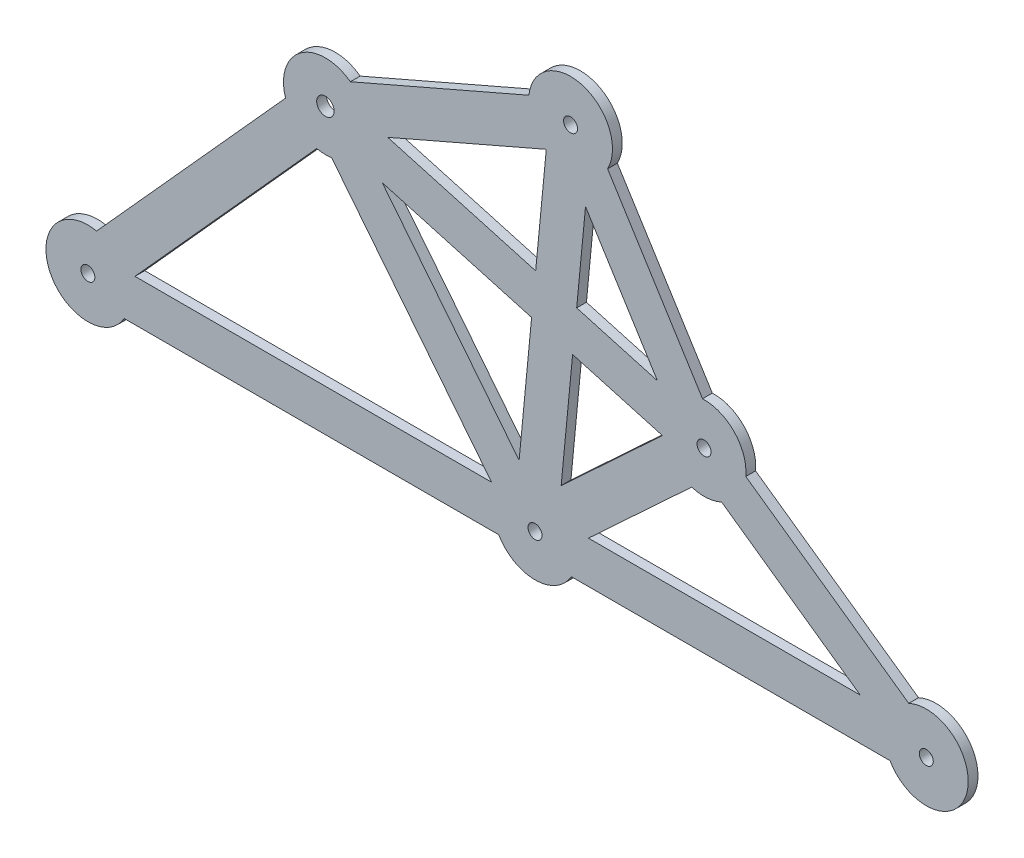
from build123d import *

# Parameters (mm, degrees)
SKETCH2_W           = 635
SKETCH2_H           = 635
BOSS_EXTRUDE3_DEPTH = 4.445
SKETCH3_R           = 3.175
SKETCH3_R_2         = 3.9751
CUT_EXTRUDE1_DEPTH  = 631.349772348
SKETCH4_W           = 635
SKETCH4_H           = 635
SKETCH4_R           = 3.175
CUT_EXTRUDE2_DEPTH  = 631.349772348


with BuildPart() as part:
    # Sketch2 → Boss-Extrude3 (new body)
    with BuildSketch(Plane.XY):
        with Locations((164.767692446, -88.380463065)):
            Rectangle(SKETCH2_W, SKETCH2_H)
    extrude(amount=BOSS_EXTRUDE3_DEPTH)

    # Sketch3 → Cut-Extrude1 (cut, through all)
    with BuildSketch(Plane(origin=(0, 0, 0), x_dir=(-1, 0, 0), z_dir=(0, 0, -1))):
        with Locations((-138.143199548, 71.871365193)):
            Circle(SKETCH3_R)
        with Locations((-198.809547248, -25.000118004)):
            Circle(SKETCH3_R)
        with Locations((-122.004659563, -96.265887155)):
            Circle(SKETCH3_R)
        with Locations((-26.754659563, 23.469712845)):
            Circle(SKETCH3_R_2)
    extrude(amount=-CUT_EXTRUDE1_DEPTH, mode=Mode.SUBTRACT)

    # Sketch4 → Cut-Extrude2 (cut, through all)
    # profile 1 of 9: a face of its own
    with BuildSketch(Plane.XY.offset(4.445)):
        with Locations((164.767692446, -88.380463065)):
            Rectangle(SKETCH4_W, SKETCH4_H)
        with BuildLine():
            Line((-77.2226341, -77.634727654), (8.633248965, 17.594597704))
            ThreePointArc((8.633248965, 17.594597704), (15.63151489, 38.935098471), (38.089671454, 38.780493538))
            Line((38.089671454, 38.780493538), (119.216168571, 74.032383096))
            ThreePointArc((119.216168571, 74.032383096), (143.785411305, 90.066637834), (154.972256192, 62.944699943))
            Line((154.972256192, 62.944699943), (198.125737804, -5.962394804))
            ThreePointArc((198.125737804, -5.962394804), (212.645203515, -11.905190907), (217.780898828, -26.729371954))
            Line((217.780898828, -26.729371954), (291.816561623, -78.971587768))
            ThreePointArc((291.816561623, -78.971587768), (317.962531349, -102.027327271), (283.306875621, -105.790887155))
            Line((283.306875621, -105.790887155), (138.502443505, -105.790887155))
            ThreePointArc((138.502443505, -105.790887155), (122.004659563, -115.315887155), (105.506875621, -105.790887155))
            Line((105.506875621, -105.790887155), (-64.697556495, -105.790887155))
            ThreePointArc((-64.697556495, -105.790887155), (-98.60087325, -104.008621005), (-77.2226341, -77.634727654))
        make_face(mode=Mode.SUBTRACT)
    # profile 2 of 9: a face of its own
    with BuildSketch(Plane.XY.offset(4.445)):
        with BuildLine():
            Line((146.273652248, -86.740887155), (269.785475941, -86.740887155))
            Line((269.785475941, -86.740887155), (206.797645188, -42.294417391))
            ThreePointArc((206.797645188, -42.294417391), (200.080272342, -44.007689067), (193.194620104, -43.203828976))
            Line((193.194620104, -43.203828976), (146.273652248, -86.740887155))
        make_face()
    # profile 3 of 9: a face of its own
    with BuildSketch(Plane.XY.offset(4.445)):
        Polygon((144.946705866, 43.06176458), (140.928758156, 1.201305791), (177.638536292, -9.140258814), align=None)
    # profile 4 of 9: a face of its own
    with BuildSketch(Plane.XY.offset(4.445)):
        Polygon((179.886249099, -29.564951481), (139.079100318, -18.069110674), (133.87810257, -72.255020413), align=None)
    # profile 5 of 9: a face of its own
    with BuildSketch(Plane.XY.offset(4.445)):
        with BuildLine():
            Line((55.070704112, 25.388502171), (122.29505865, 6.450632186))
            Line((122.29505865, 6.450632186), (127.085491453, 56.359125133))
            ThreePointArc((127.085491453, 56.359125133), (126.946386449, 56.459231128), (126.808187657, 56.5605845))
            Line((126.808187657, 56.5605845), (55.070704112, 25.388502171))
        make_face()
    # profile 6 of 9: a face of its own
    with BuildSketch(Plane.XY.offset(4.445)):
        Polygon((120.445400812, -12.81978428), (52.587094953, 6.296677047), (114.776579601, -71.879651121), align=None)
    # profile 7 of 9: a face of its own
    with BuildSketch(Plane.XY.offset(4.445)):
        with BuildLine():
            Line((102.256257742, -86.740887155), (29.57120013, 4.629075933))
            ThreePointArc((29.57120013, 4.629075933), (26.167164867, 4.428774056), (22.781953227, 4.838553344))
            Line((22.781953227, 4.838553344), (-59.783303905, -86.740887155))
            Line((-59.783303905, -86.740887155), (102.256257742, -86.740887155))
        make_face()
    # profile 8 of 9: a face of its own
    with BuildSketch(Plane.XY.offset(4.445)):
        with Locations((299.804659563, -96.265887155)):
            Circle(SKETCH4_R)
    # profile 9 of 9: a face of its own
    with BuildSketch(Plane.XY.offset(4.445)):
        with Locations((-81.195340437, -96.265887155)):
            Circle(SKETCH4_R)
    extrude(amount=-CUT_EXTRUDE2_DEPTH, mode=Mode.SUBTRACT)


solid = part.part
